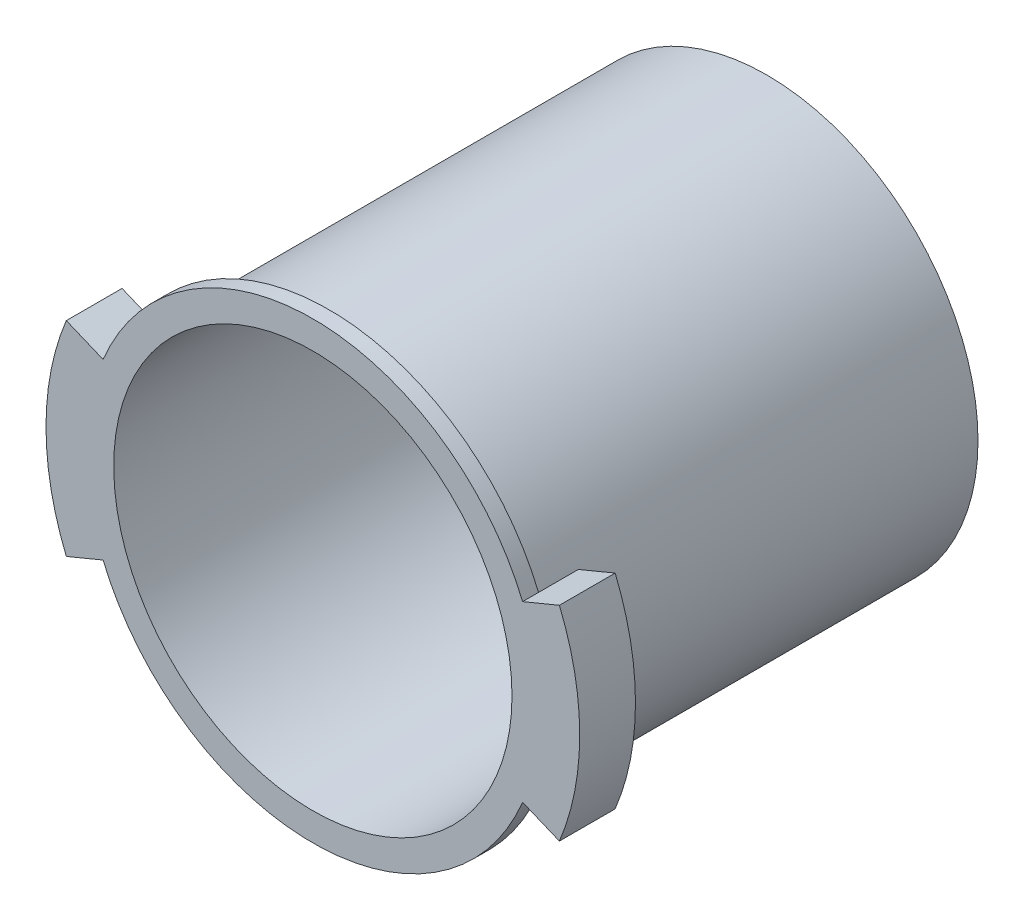
from build123d import *

# Parameters (mm, degrees)
SKETCH1_R           = 26.5
SKETCH1_R_2         = 25
BOSS_EXTRUDE1_DEPTH = 55
SKETCH2_R           = 25
BOSS_EXTRUDE2_DEPTH = 2
BOSS_EXTRUDE3_START = 5
BOSS_EXTRUDE3_DEPTH = 5
SKETCH5_W           = 20
SKETCH5_H           = 10
CUT_EXTRUDE1_DEPTH  = 68
BOSS_EXTRUDE4_DEPTH = 2


with BuildPart() as part:
    # Sketch1 → Boss-Extrude1 (new body)
    with BuildSketch(Plane.XY):
        Circle(SKETCH1_R)
        Circle(SKETCH1_R_2, mode=Mode.SUBTRACT)
    extrude(amount=BOSS_EXTRUDE1_DEPTH)

    # Sketch2 → Boss-Extrude2 (add)
    with BuildSketch(Plane.XY.offset(55)):
        with BuildLine():
            Line((-26.330566677, 10.906477822), (-30.949964339, 12.819894984))
            ThreePointArc((-30.949964339, 12.819894984), (-33.5, 0), (-30.949964339, -12.819894984))
            Line((-30.949964339, -12.819894984), (-26.330566677, -10.906477822))
            ThreePointArc((-26.330566677, -10.906477822), (0, -28.5), (26.330566677, -10.906477822))
            Line((26.330566677, -10.906477822), (30.949964339, -12.819894984))
            ThreePointArc((30.949964339, -12.819894984), (33.5, 0), (30.949964339, 12.819894984))
            Line((30.949964339, 12.819894984), (26.330566677, 10.906477822))
            ThreePointArc((26.330566677, 10.906477822), (0, 28.5), (-26.330566677, 10.906477822))
        make_face()
        Circle(SKETCH2_R, mode=Mode.SUBTRACT)
    extrude(amount=BOSS_EXTRUDE2_DEPTH)

    # Sketch3 → Boss-Extrude3 (add)
    with BuildSketch(Plane(origin=(0, 0, 55), x_dir=(-1, 0, 0), z_dir=(0, 0, -1)).offset(BOSS_EXTRUDE3_START)):
        with BuildLine():
            ThreePointArc((-26.330566677, -10.906477822), (-28.5, 0), (-26.330566677, 10.906477822))
            Line((-26.330566677, 10.906477822), (-30.949964339, 12.819894984))
            ThreePointArc((-30.949964339, 12.819894984), (-33.5, 0), (-30.949964339, -12.819894984))
            Line((-30.949964339, -12.819894984), (-26.330566677, -10.906477822))
        make_face()
        with BuildLine():
            Line((30.949964339, 12.819894984), (26.330566677, 10.906477822))
            ThreePointArc((26.330566677, 10.906477822), (27.952380491, 5.560074177), (28.5, 0))
            ThreePointArc((28.5, 0), (27.952380491, -5.560074177), (26.330566677, -10.906477822))
            Line((26.330566677, -10.906477822), (30.949964339, -12.819894984))
            ThreePointArc((30.949964339, -12.819894984), (33.5, 0), (30.949964339, 12.819894984))
        make_face()
    extrude(amount=-BOSS_EXTRUDE3_DEPTH)

    # Sketch5 → Cut-Extrude1 (cut)
    with BuildSketch(Plane(origin=(0, 0, 20), x_dir=(-1, 0, 0), z_dir=(0, 0, -1))):
        with Locations((0, -25)):
            Rectangle(SKETCH5_W, SKETCH5_H)
    extrude(amount=CUT_EXTRUDE1_DEPTH, mode=Mode.SUBTRACT)

    # Sketch7 → Boss-Extrude4 (add)
    with BuildSketch(Plane(origin=(0, 0, 15), x_dir=(-1, 0, 0), z_dir=(0, 0, -1))):
        with BuildLine():
            ThreePointArc((-21.931712199, -12), (-23.475679338, -8.596073501), (-24.494897428, -5))
            Line((-24.494897428, -5), (-17.5, -5))
            ThreePointArc((-17.5, -5), (-14, -8.5), (-17.5, -12))
            Line((-17.5, -12), (-21.931712199, -12))
        make_face()
        with BuildLine():
            Line((21.931712199, -12), (17.5, -12))
            ThreePointArc((17.5, -12), (14, -8.5), (17.5, -5))
            Line((17.5, -5), (24.494897428, -5))
            ThreePointArc((24.494897428, -5), (23.475679338, -8.596073501), (21.931712199, -12))
        make_face()
    extrude(amount=-BOSS_EXTRUDE4_DEPTH)


solid = part.part
